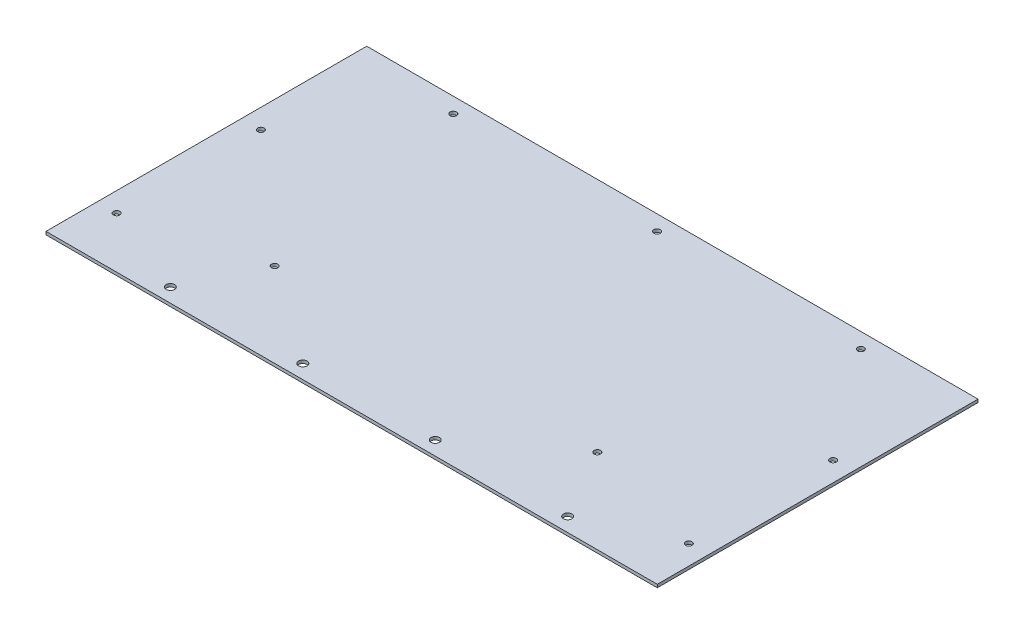
from build123d import *

# Parameters (mm, degrees)
SKETCH1_W            = 457.223
SKETCH1_H            = 2.286
BOSS_EXTRUDE1_DEPTH  = 238.315200026
SKETCH9_R            = 3.175
CUT_EXTRUDE10_DEPTH  = 2.54
LPATTERN1_COUNT      = 4
LPATTERN1_PITCH      = 99.06
SKETCH15_W           = 457.223
SKETCH15_H           = 2.286
BOSS_EXTRUDE3_DEPTH  = 1.5875
M4_CLEARANCE_HOLE1_D = 4.8


with BuildPart() as part:
    # Sketch1 → Boss-Extrude1 (new body)
    with BuildSketch(Plane.XY):
        Rectangle(SKETCH1_W, SKETCH1_H)
    extrude(amount=BOSS_EXTRUDE1_DEPTH)

    # Sketch9 → Cut-Extrude10 (cut)
    with BuildSketch(Plane(origin=(0, 1.143, 0), x_dir=(1, 0, 0), z_dir=(0, 1, 0))):
        with Locations(Location((-146.0615, -229.425200026, 0), (0, 0, 270))):
            Circle(SKETCH9_R)
    cut_extrude10 = extrude(amount=-CUT_EXTRUDE10_DEPTH, mode=Mode.SUBTRACT)

    # LPattern1: Cut-Extrude10 ×4
    with Locations(*[(i * LPATTERN1_PITCH, 0, 0) for i in range(1, LPATTERN1_COUNT)]):
        add(cut_extrude10, mode=Mode.SUBTRACT)

    # Sketch15 → Boss-Extrude3 (add)
    with BuildSketch(Plane.XY.offset(238.315200026)):
        Rectangle(SKETCH15_W, SKETCH15_H)
    extrude(amount=BOSS_EXTRUDE3_DEPTH)

    # M4 Clearance Hole1 (through all)
    with Locations(Plane.XZ.offset(1.143)):
        with Locations((-214.0065, 201.724823778), (-214.0065, 93.774823778), (-152.4, 11.43), (0, 11.43), (152.4, 11.43), (214.0065, 93.774823778), (214.0065, 201.724823778), (120.65, 176.776), (-120.65, 176.776)):
            Hole(M4_CLEARANCE_HOLE1_D / 2)


solid = part.part
